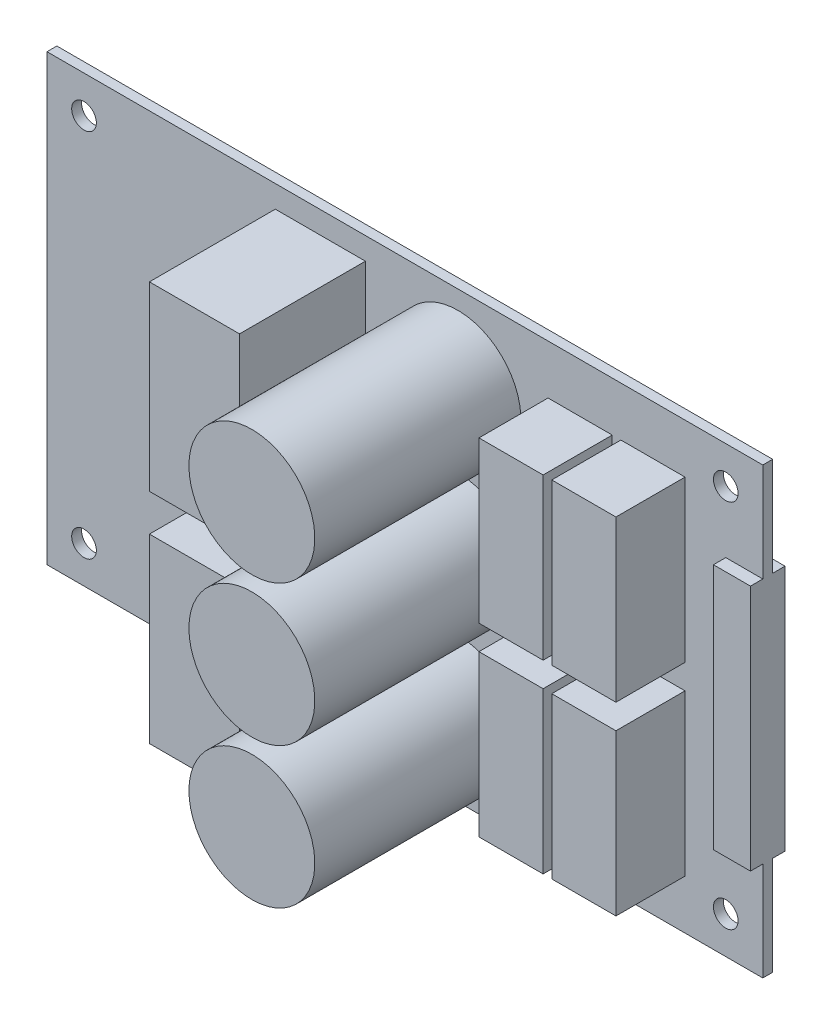
from build123d import *

# Parameters (mm, degrees)
SKETCH_1_W      = 58
SKETCH_1_H      = 36
SKETCH_1_R      = 1
EXTRUDE_1_DEPTH = 0.8
SKETCH_2_W      = 1.8
SKETCH_2_H      = 1.8
EXTRUDE_2_DEPTH = 1
EXTRUDE_START   = -0.8
SKETCH_2_3_W    = 5.2
SKETCH_2_3_H    = 13
EXTRUDE_3_DEPTH = 5.6
SKETCH_3_W      = 1.5
SKETCH_3_H      = 8.7
EXTRUDE_4_DEPTH = 1
SKETCH_3_3_W    = 7.3
SKETCH_3_3_H    = 14.7
EXTRUDE_5_DEPTH = 10.2
SKETCH_4_W      = 2
SKETCH_4_H      = 2
EXTRUDE_6_DEPTH = 1
SKETCH_4_3_R    = 5.1
EXTRUDE_7_DEPTH = 16.7
SKETCH_5_W      = 3
SKETCH_5_H      = 20
EXTRUDE_8_DEPTH = 1
SKETCH_5_2_W    = 3
SKETCH_5_2_H    = 20
EXTRUDE_9_DEPTH = 1


with BuildPart() as part:
    # 草图1 → 凸台-拉伸1 (new body)
    with BuildSketch(Plane.XY):
        Rectangle(SKETCH_1_W, SKETCH_1_H)
        with Locations((-26, -15)):
            Circle(SKETCH_1_R, mode=Mode.SUBTRACT)
        with Locations((-26, 15)):
            Circle(SKETCH_1_R, mode=Mode.SUBTRACT)
        with Locations((26, 15)):
            Circle(SKETCH_1_R, mode=Mode.SUBTRACT)
        with Locations((26, -15)):
            Circle(SKETCH_1_R, mode=Mode.SUBTRACT)
    extrude(amount=EXTRUDE_1_DEPTH)

    # 草图2 → 凸台-拉伸2 (add)
    with BuildSketch(Plane(origin=(0, 0, 0), x_dir=(-1, 0, 0), z_dir=(0, 0, -1))):
        with Locations((-20.1, -13.1)):
            Rectangle(SKETCH_2_W, SKETCH_2_H)
        with Locations((-20.1, -1.9)):
            Rectangle(SKETCH_2_W, SKETCH_2_H)
        with Locations((-20.1, 1.9)):
            Rectangle(SKETCH_2_W, SKETCH_2_H)
        with Locations((-20.1, 13.1)):
            Rectangle(SKETCH_2_W, SKETCH_2_H)
        with Locations((-14.2, 13.1)):
            Rectangle(SKETCH_2_W, SKETCH_2_H)
        with Locations((-14.2, 1.9)):
            Rectangle(SKETCH_2_W, SKETCH_2_H)
        with Locations((-14.2, -1.9)):
            Rectangle(SKETCH_2_W, SKETCH_2_H)
        with Locations((-14.2, -13.1)):
            Rectangle(SKETCH_2_W, SKETCH_2_H)
    extrude(amount=EXTRUDE_2_DEPTH)

    # 草图2<3> → 凸台-拉伸3 (add)
    with BuildSketch(Plane(origin=(0, 0, 0), x_dir=(-1, 0, 0), z_dir=(0, 0, -1)).offset(EXTRUDE_START)):
        with Locations((-20.1, 7.5)):
            Rectangle(SKETCH_2_3_W, SKETCH_2_3_H)
        with Locations((-14.2, 7.5)):
            Rectangle(SKETCH_2_3_W, SKETCH_2_3_H)
        with Locations((-20.1, -7.5)):
            Rectangle(SKETCH_2_3_W, SKETCH_2_3_H)
        with Locations((-14.2, -7.5)):
            Rectangle(SKETCH_2_3_W, SKETCH_2_3_H)
    extrude(amount=-EXTRUDE_3_DEPTH)

    # 草图3 → 凸台-拉伸4 (add)
    with BuildSketch(Plane(origin=(0, 0, 0), x_dir=(-1, 0, 0), z_dir=(0, 0, -1))):
        with Locations((9.75, 8.85)):
            Rectangle(SKETCH_3_W, SKETCH_3_H)
        with Locations((9.75, -8.85)):
            Rectangle(SKETCH_3_W, SKETCH_3_H)
    extrude(amount=EXTRUDE_4_DEPTH)

    # 草图3<3> → 凸台-拉伸5 (add)
    with BuildSketch(Plane(origin=(0, 0, 0), x_dir=(-1, 0, 0), z_dir=(0, 0, -1)).offset(EXTRUDE_START)):
        with Locations((6.85, 8.85)):
            Rectangle(SKETCH_3_3_W, SKETCH_3_3_H)
        with Locations((6.85, -8.85)):
            Rectangle(SKETCH_3_3_W, SKETCH_3_3_H)
    extrude(amount=-EXTRUDE_5_DEPTH)

    # 草图4 → 凸台-拉伸6 (add)
    with BuildSketch(Plane(origin=(0, 0, 0), x_dir=(-1, 0, 0), z_dir=(0, 0, -1))):
        with Locations((-5.8, 0)):
            Rectangle(SKETCH_4_W, SKETCH_4_H)
        with Locations((-2.8, 0)):
            Rectangle(SKETCH_4_W, SKETCH_4_H)
        with Locations((-5.8, 11.4)):
            Rectangle(SKETCH_4_W, SKETCH_4_H)
        with Locations((-2.8, 11.4)):
            Rectangle(SKETCH_4_W, SKETCH_4_H)
        with Locations((-5.8, -11.4)):
            Rectangle(SKETCH_4_W, SKETCH_4_H)
        with Locations((-2.8, -11.4)):
            Rectangle(SKETCH_4_W, SKETCH_4_H)
    extrude(amount=EXTRUDE_6_DEPTH)

    # 草图4<3> → 凸台-拉伸7 (add)
    with BuildSketch(Plane(origin=(0, 0, 0), x_dir=(-1, 0, 0), z_dir=(0, 0, -1)).offset(EXTRUDE_START)):
        with Locations((-4.3, 0)):
            Circle(SKETCH_4_3_R)
        with Locations((-4.3, 11.4)):
            Circle(SKETCH_4_3_R)
        with Locations((-4.3, -11.4)):
            Circle(SKETCH_4_3_R)
    extrude(amount=-EXTRUDE_7_DEPTH)

    # 草图5 → 凸台-拉伸8 (add)
    with BuildSketch(Plane(origin=(0, 0, 0), x_dir=(-1, 0, 0), z_dir=(0, 0, -1))):
        with Locations((-27.5, 0)):
            Rectangle(SKETCH_5_W, SKETCH_5_H)
    extrude(amount=EXTRUDE_8_DEPTH)

    # 草图5<2> → 凸台-拉伸9 (add)
    with BuildSketch(Plane(origin=(0, 0, 0), x_dir=(-1, 0, 0), z_dir=(0, 0, -1)).offset(EXTRUDE_START)):
        with Locations((-27.5, 0)):
            Rectangle(SKETCH_5_2_W, SKETCH_5_2_H)
    extrude(amount=-EXTRUDE_9_DEPTH)


solid = part.part
